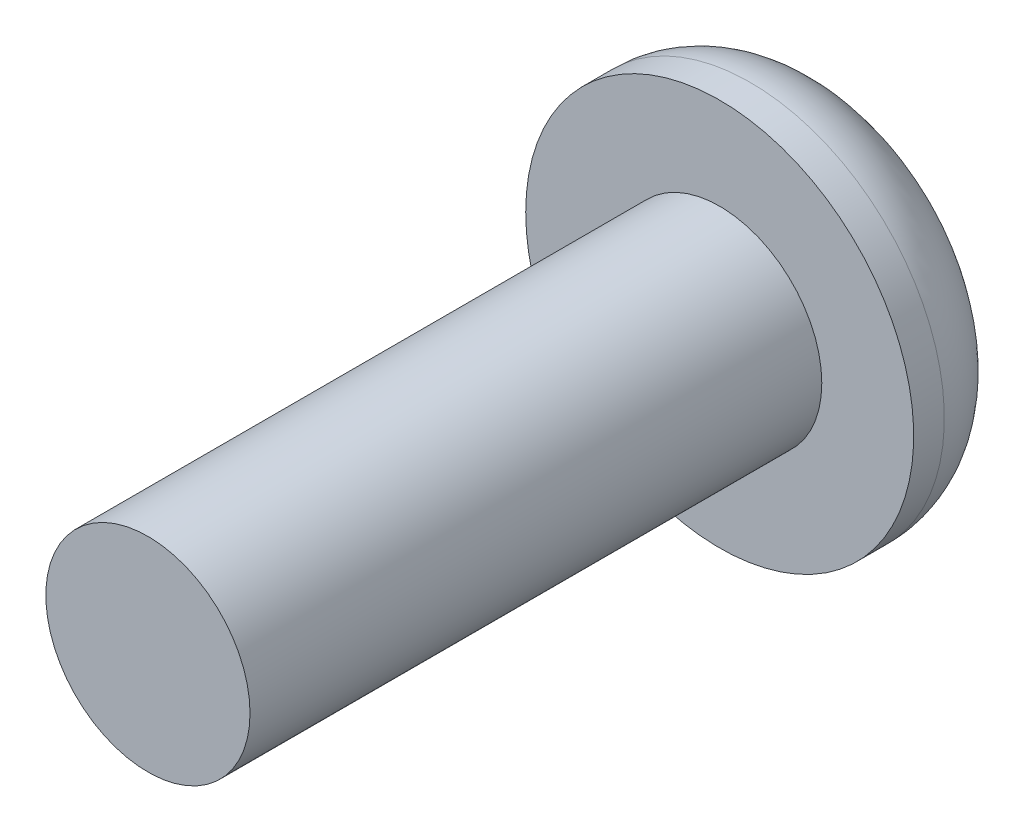
from build123d import *

# Parameters (mm, degrees)
SKETCH_1_R      = 2.5
EXTRUDE_1_DEPTH = 14
SKETCH_2_R      = 4.75
EXTRUDE_2_DEPTH = 2.75
FILLET_1_R      = 2


with BuildPart() as part:
    # 草图1 → 凸台-拉伸1 (new body)
    with BuildSketch(Plane.XY):
        Circle(SKETCH_1_R)
    extrude(amount=EXTRUDE_1_DEPTH)

    # 草图2 → 凸台-拉伸2 (add)
    with BuildSketch(Plane(origin=(0, 0, 0), x_dir=(-1, 0, 0), z_dir=(0, 0, -1))):
        Circle(SKETCH_2_R)
    extrude(amount=EXTRUDE_2_DEPTH)

    # 圆角1
    fillet_1_edges = [part.edges().sort_by_distance(p)[0] for p in [
        (4.75, 0, -2.75),
    ]]
    fillet(fillet_1_edges, radius=FILLET_1_R)


solid = part.part
